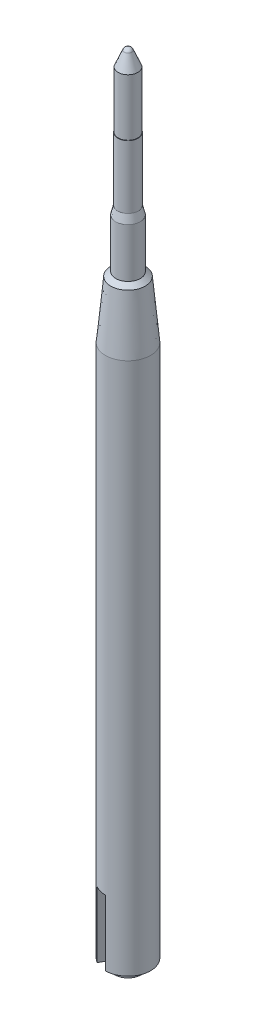
from build123d import *

# Parameters (mm, degrees)
SKIZZE2_W               = 3
SKIZZE2_H               = 9
SCHNITT_ROTATION1_ANGLE = 30


with BuildPart() as part:
    # Skizze1 → Rotation1 (revolve)
    with BuildSketch(Plane.XY, mode=Mode.PRIVATE) as rotation1_sk:
        with BuildLine():
            Line((1.25, -17.5), (1.5, -18.5))
            Line((1.5, -18.5), (1.5, -24.5))
            Line((1.5, -24.5), (2.1, -25))
            Line((2.1, -25), (2.75, -32))
            Line((2.75, -32), (2.75, -97))
            Line((2.75, -97), (1.6, -97))
            Line((1.6, -97), (1.6, -98))
            Line((1.6, -98), (0, -98))
            Line((0, -98), (0, -0.8))
            ThreePointArc((0, -0.8), (0.277350098, -0.883974853), (0.461538462, -1.107692308))
            Line((0.461538462, -1.107692308), (1.2, -2.88))
            Line((1.2, -2.88), (1.2, -9.8))
            Line((1.2, -9.8), (1.25, -9.8))
            Line((1.25, -9.8), (1.25, -17.5))
        make_face()
    revolve(rotation1_sk.sketch.rotate(Axis((0, 4.010416667, 0), (0, -1, 0)), 90), axis=Axis((0, 4.010416667, 0), (0, -1, 0)))

    # Skizze2 → Schnitt-Rotation1 (revolve, cut)
    with BuildSketch(Plane(origin=(0, 0, 0), x_dir=(0, 0, -1), z_dir=(1, 0, 0))):
        with Locations((-3.1, -93.5)):
            Rectangle(SKIZZE2_W, SKIZZE2_H)
        with Locations((3.1, -93.5)):
            Rectangle(SKIZZE2_W, SKIZZE2_H)
    revolve(axis=Axis((0, -78.967863002, 0), (0, -1, 0)), revolution_arc=SCHNITT_ROTATION1_ANGLE, mode=Mode.SUBTRACT)


solid = part.part
